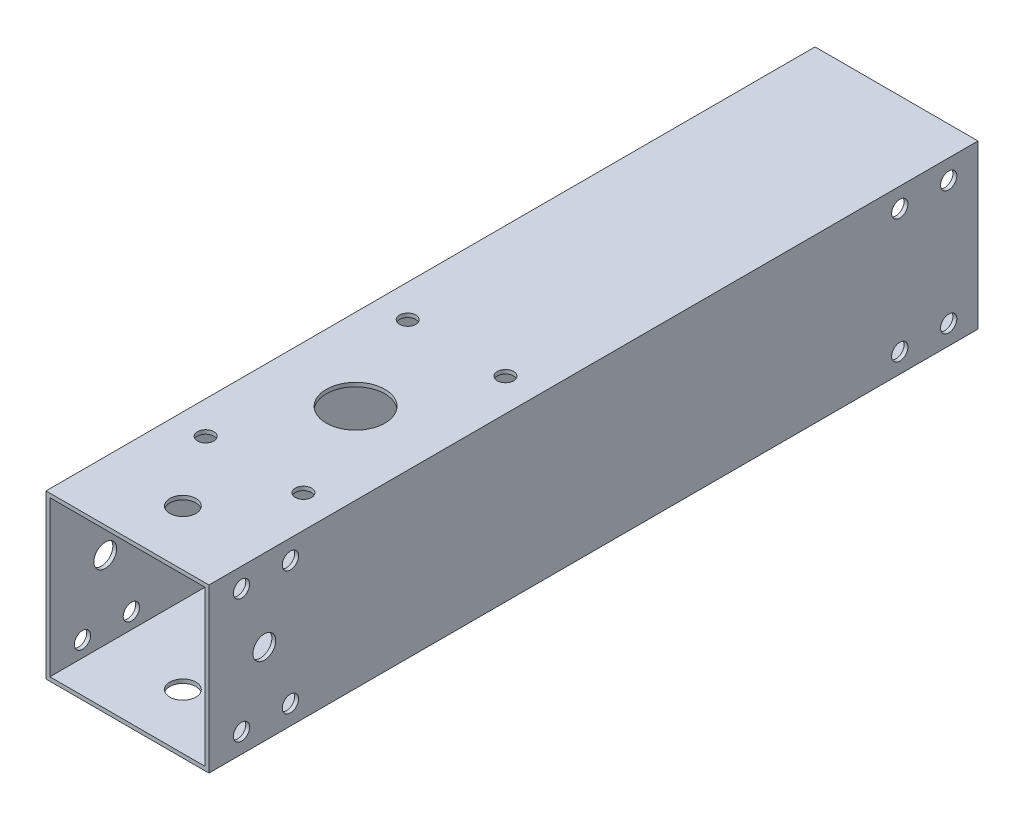
from build123d import *

# Parameters (mm, degrees)
CROQUIS1_W              = 50
CROQUIS1_H              = 50
CROQUIS1_W_2            = 47.6
CROQUIS1_H_2            = 47.6
SALIENTE_EXTRUIR1_DEPTH = 237
CROQUIS2_R              = 2.5
CROQUIS2_R_2            = 3.5
CORTAR_EXTRUIR1_DEPTH   = 244.503593403
CHAFL_N1_SIZE           = 1
CROQUIS3_R              = 4
CORTAR_EXTRUIR2_DEPTH   = 244.503593403
CROQUIS4_R              = 9
CORTAR_EXTRUIR3_DEPTH   = 244.503593403
CROQUIS5_R              = 2.5
CORTAR_EXTRUIR4_DEPTH   = 2


with BuildPart() as part:
    # Croquis1 → Saliente-Extruir1 (new body)
    with BuildSketch(Plane.XY):
        Rectangle(CROQUIS1_W, CROQUIS1_H)
        Rectangle(CROQUIS1_W_2, CROQUIS1_H_2, mode=Mode.SUBTRACT)
    extrude(amount=SALIENTE_EXTRUIR1_DEPTH)

    # Croquis2 → Cortar-Extruir1 (cut, through all)
    with BuildSketch(Plane(origin=(25, 0, 0), x_dir=(0, 0, -1), z_dir=(1, 0, 0))):
        with Locations(Location((-10, 19, 0), (0, 0, 90))):
            Circle(CROQUIS2_R)
        with Locations(Location((-25, 19, 0), (0, 0, 90))):
            Circle(CROQUIS2_R)
        with Locations(Location((-25, -19, 0), (0, 0, 90))):
            Circle(CROQUIS2_R)
        with Locations(Location((-10, -19, 0), (0, 0, 90))):
            Circle(CROQUIS2_R)
        with Locations(Location((-227, 19, 0), (0, 0, 90))):
            Circle(CROQUIS2_R)
        with Locations(Location((-212, 19, 0), (0, 0, 90))):
            Circle(CROQUIS2_R)
        with Locations(Location((-212, -19, 0), (0, 0, 90))):
            Circle(CROQUIS2_R)
        with Locations(Location((-227, -19, 0), (0, 0, 90))):
            Circle(CROQUIS2_R)
        with Locations(Location((-220, 0, 0), (0, 0, 90))):
            Circle(CROQUIS2_R_2)
    extrude(amount=-CORTAR_EXTRUIR1_DEPTH, mode=Mode.SUBTRACT)

    # Chaflán1
    chafl_n1_edges = [part.edges().sort_by_distance(p)[0] for p in [
        (0, -25, 0),
        (-25, 0, 0),
        (0, 25, 0),
        (25, 0, 0),
    ]]
    chamfer(chafl_n1_edges, length=CHAFL_N1_SIZE)

    # Croquis3 → Cortar-Extruir2 (cut, through all)
    with BuildSketch(Plane(origin=(0, 25, 0), x_dir=(1, 0, 0), z_dir=(0, 1, 0))):
        with Locations(Location((0, -220, 0), (0, 0, 270))):
            Circle(CROQUIS3_R)
    extrude(amount=-CORTAR_EXTRUIR2_DEPTH, mode=Mode.SUBTRACT)

    # Croquis4 → Cortar-Extruir3 (cut, through all)
    with BuildSketch(Plane(origin=(0, 25, 0), x_dir=(1, 0, 0), z_dir=(0, 1, 0))):
        with Locations(Location((0, -167, 0), (0, 0, 270))):
            Circle(CROQUIS4_R)
    extrude(amount=-CORTAR_EXTRUIR3_DEPTH, mode=Mode.SUBTRACT)

    # Croquis5 → Cortar-Extruir4 (cut)
    with BuildSketch(Plane(origin=(0, 25, 0), x_dir=(1, 0, 0), z_dir=(0, 1, 0))):
        with Locations(Location((-15, -136, 0), (0, 0, 270))):
            Circle(CROQUIS5_R)
        with Locations(Location((15, -136, 0), (0, 0, 270))):
            Circle(CROQUIS5_R)
        with Locations(Location((-15, -198, 0), (0, 0, 270))):
            Circle(CROQUIS5_R)
        with Locations(Location((15, -198, 0), (0, 0, 270))):
            Circle(CROQUIS5_R)
    extrude(amount=-CORTAR_EXTRUIR4_DEPTH, mode=Mode.SUBTRACT)


solid = part.part
